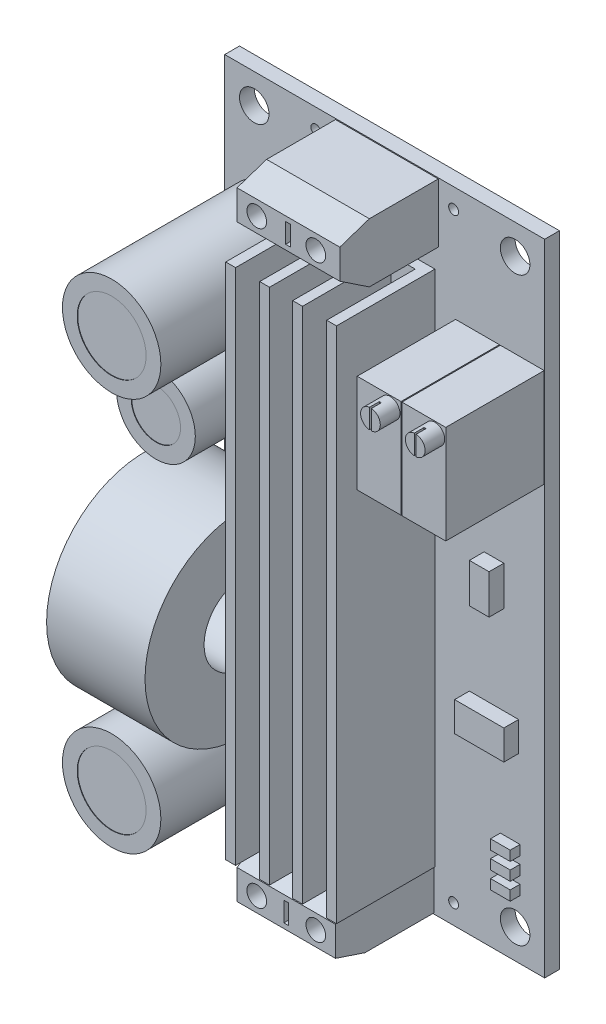
from build123d import *

# Parameters (mm, degrees)
SKETCH_1_W          = 32.5
SKETCH_1_H          = 65
SKETCH_1_R          = 1.5
EXTRUDE_1_DEPTH     = 1.5
SKETCH_2_W          = 10
SKETCH_2_H          = 6
SKETCH_2_W_2        = 10.441290105
EXTRUDE_2_DEPTH     = 10
CUT_EXTRUDE_1_DEPTH = 70.345601879
CUT_EXTRUDE_2_DEPTH = 70.482098892
SKETCH_5_W          = 4.45
SKETCH_5_H          = 10
EXTRUDE_3_DEPTH     = 10
SKETCH_6_R          = 1
EXTRUDE_4_DEPTH     = 2
SKETCH_7_W          = 0.2
SKETCH_7_H          = 2.567664245
SKETCH_7_H_2        = 2.899799918
CUT_EXTRUDE_3_DEPTH = 1
SKETCH_8_R          = 5
EXTRUDE_5_DEPTH     = 16.5
SKETCH_9_R          = 4
EXTRUDE_6_DEPTH     = 12
SKETCH_10_R         = 10
SKETCH_10_R_2       = 4
EXTRUDE_7_DEPTH     = 10
SKETCH_11_R         = 0.5
CUT_EXTRUDE_4_DEPTH = 76.400663127
SKETCH_14_W         = 11.252561251
SKETCH_14_H         = 52.6
EXTRUDE_8_DEPTH     = 1
SKETCH_15_W         = 1
SKETCH_15_H         = 52.6
EXTRUDE_9_DEPTH     = 9
SKETCH_16_W         = 5
SKETCH_16_H         = 3
SKETCH_16_W_2       = 2
SKETCH_16_H_2       = 4
EXTRUDE_10_DEPTH    = 1.5
SKETCH_17_W         = 2
SKETCH_17_H         = 1
EXTRUDE_11_DEPTH    = 1
SKETCH_18_R         = 3.5
CUT_EXTRUDE_5_DEPTH = 0.05
SKETCH_19_R         = 2.5
CUT_EXTRUDE_6_DEPTH = 0.05
SKETCH_20_R         = 1
SKETCH_20_W         = 0.5
SKETCH_20_H         = 2
CUT_EXTRUDE_7_DEPTH = 2


with BuildPart() as part:
    # 草图1 → 凸台-拉伸1 (new body)
    with BuildSketch(Plane.XY):
        with Locations((16.25, 32.5)):
            Rectangle(SKETCH_1_W, SKETCH_1_H)
        with Locations((3, 62)):
            Circle(SKETCH_1_R, mode=Mode.SUBTRACT)
        with Locations((29.5, 3)):
            Circle(SKETCH_1_R, mode=Mode.SUBTRACT)
        with Locations((3, 3)):
            Circle(SKETCH_1_R, mode=Mode.SUBTRACT)
        with Locations((29.5, 62)):
            Circle(SKETCH_1_R, mode=Mode.SUBTRACT)
    extrude(amount=EXTRUDE_1_DEPTH)

    # 草图2 → 凸台-拉伸2 (add)
    with BuildSketch(Plane.XY.offset(1.5)):
        with Locations((16.25, 3.1)):
            Rectangle(SKETCH_2_W, SKETCH_2_H)
        with Locations((16.470645053, 61.9)):
            Rectangle(SKETCH_2_W_2, SKETCH_2_H)
    extrude(amount=EXTRUDE_2_DEPTH)

    # 草图3 → 切除-拉伸1 (cut, through all)
    with BuildSketch(Plane(origin=(21.25, 0, 0), x_dir=(0, 0, -1), z_dir=(1, 0, 0))):
        Polygon((-11.5, 0.1), (-11.5, 1.1), (-8.5, 0.1), (-11.210765393, 0.1), align=None)
        Polygon((-11.5, 4.1), (-11.5, 6.1), (-8.5, 6.1), align=None)
    extrude(amount=-CUT_EXTRUDE_1_DEPTH, mode=Mode.SUBTRACT)

    # 草图4 → 切除-拉伸2 (cut, through all)
    with BuildSketch(Plane(origin=(21.691290105, 0, 0), x_dir=(0, 0, -1), z_dir=(1, 0, 0))):
        Polygon((-11.5, 58.9), (-11.5, 60.9), (-8.5, 58.9), align=None)
        Polygon((-11.5, 63.9), (-11.5, 64.9), (-8.5, 64.9), align=None)
    extrude(amount=-CUT_EXTRUDE_2_DEPTH, mode=Mode.SUBTRACT)

    # 草图5 → 凸台-拉伸3 (add)
    with BuildSketch(Plane.XY.offset(1.5)):
        with Locations((25.677561251, 48.421530787)):
            Rectangle(SKETCH_5_W, SKETCH_5_H)
        with Locations((30.227561251, 48.421530787)):
            Rectangle(SKETCH_5_W, SKETCH_5_H)
    extrude(amount=EXTRUDE_3_DEPTH)

    # 草图6 → 凸台-拉伸4 (add)
    with BuildSketch(Plane.XY.offset(11.5)):
        with Locations(Location((26.802561251, 52.321530787, 0), (0, 0, 180))):
            Circle(SKETCH_6_R)
        with Locations(Location((31.352561251, 52.321530787, 0), (0, 0, 180))):
            Circle(SKETCH_6_R)
    extrude(amount=EXTRUDE_4_DEPTH)

    # 草图7 → 切除-拉伸3 (cut)
    with BuildSketch(Plane.XY.offset(13.5)):
        with Locations((26.802561251, 52.351074518)):
            Rectangle(SKETCH_7_W, SKETCH_7_H)
        with Locations((31.352561251, 52.389397866)):
            Rectangle(SKETCH_7_W, SKETCH_7_H_2)
    extrude(amount=-CUT_EXTRUDE_3_DEPTH, mode=Mode.SUBTRACT)

    # 草图8 → 凸台-拉伸5 (add)
    with BuildSketch(Plane.XY.offset(1.5)):
        with Locations(Location((5.01, 11, 0), (0, 0, 180))):
            Circle(SKETCH_8_R)
        with Locations(Location((5.01, 51, 0), (0, 0, 180))):
            Circle(SKETCH_8_R)
    extrude(amount=EXTRUDE_5_DEPTH)

    # 草图9 → 凸台-拉伸6 (add)
    with BuildSketch(Plane.XY.offset(1.5)):
        with Locations(Location((5.01, 41.9, 0), (0, 0, 180))):
            Circle(SKETCH_9_R)
    extrude(amount=EXTRUDE_6_DEPTH)

    # 草图11 → 切除-拉伸4 (cut, through all)
    with BuildSketch(Plane.XY.offset(1.5)):
        with Locations((23.25, 2)):
            Circle(SKETCH_11_R)
        with Locations((9.25, 63)):
            Circle(SKETCH_11_R)
        with Locations((23.25, 63)):
            Circle(SKETCH_11_R)
        with Locations((9.25, 2)):
            Circle(SKETCH_11_R)
    extrude(amount=-CUT_EXTRUDE_4_DEPTH, mode=Mode.SUBTRACT)

    # 草图16 → 凸台-拉伸10 (add)
    with BuildSketch(Plane.XY.offset(1.5)):
        with Locations((27.352561251, 19.921530787)):
            Rectangle(SKETCH_16_W, SKETCH_16_H)
        with Locations((27.352561251, 32.421530787)):
            Rectangle(SKETCH_16_W_2, SKETCH_16_H_2)
    extrude(amount=EXTRUDE_10_DEPTH)

    # 草图17 → 凸台-拉伸11 (add)
    with BuildSketch(Plane.XY.offset(1.5)):
        with Locations((29, 6.5)):
            Rectangle(SKETCH_17_W, SKETCH_17_H)
        with Locations((29, 8.25)):
            Rectangle(SKETCH_17_W, SKETCH_17_H)
        with Locations((29, 10)):
            Rectangle(SKETCH_17_W, SKETCH_17_H)
    extrude(amount=EXTRUDE_11_DEPTH)

    # 草图18 → 切除-拉伸5 (cut)
    with BuildSketch(Plane.XY.offset(18)):
        with Locations((5.01, 11)):
            Circle(SKETCH_18_R)
        with Locations((5.01, 51)):
            Circle(SKETCH_18_R)
    extrude(amount=-CUT_EXTRUDE_5_DEPTH, mode=Mode.SUBTRACT)

    # 草图19 → 切除-拉伸6 (cut)
    with BuildSketch(Plane.XY.offset(13.5)):
        with Locations((5.01, 41.9)):
            Circle(SKETCH_19_R)
    extrude(amount=-CUT_EXTRUDE_6_DEPTH, mode=Mode.SUBTRACT)

    # 草图20 → 切除-拉伸7 (cut)
    with BuildSketch(Plane.XY.offset(11.5)):
        with Locations((19.25, 2.6)):
            Circle(SKETCH_20_R)
        with Locations((13.25, 2.6)):
            Circle(SKETCH_20_R)
        with Locations((19.25, 62.4)):
            Circle(SKETCH_20_R)
        with Locations((13.25, 62.4)):
            Circle(SKETCH_20_R)
        with Locations((16.25, 2.6)):
            Rectangle(SKETCH_20_W, SKETCH_20_H)
        with Locations((16.441290105, 62.4)):
            Rectangle(SKETCH_20_W, SKETCH_20_H)
    extrude(amount=-CUT_EXTRUDE_7_DEPTH, mode=Mode.SUBTRACT)


with BuildPart() as body_2:
    # 草图10 → 凸台-拉伸7 (new body)
    with BuildSketch(Plane.ZY.offset(-2)):
        with Locations((11.6, 26.1)):
            Circle(SKETCH_10_R)
        with Locations((11.6, 26.1)):
            Circle(SKETCH_10_R_2, mode=Mode.SUBTRACT)
    extrude(amount=-EXTRUDE_7_DEPTH)


with BuildPart() as body_3:
    # 草图14 → 凸台-拉伸8 (new body)
    with BuildSketch(Plane.XY.offset(3.5)):
        with Locations((17.726280626, 32.5)):
            Rectangle(SKETCH_14_W, SKETCH_14_H)
    extrude(amount=EXTRUDE_8_DEPTH)

    # 草图15 → 凸台-拉伸9 (add)
    with BuildSketch(Plane.XY.offset(4.5)):
        with Locations((22.852561251, 32.5)):
            Rectangle(SKETCH_15_W, SKETCH_15_H)
        with Locations((12.6, 32.5)):
            Rectangle(SKETCH_15_W, SKETCH_15_H)
        with Locations((19.402561251, 32.5)):
            Rectangle(SKETCH_15_W, SKETCH_15_H)
        with Locations((16.05, 32.5)):
            Rectangle(SKETCH_15_W, SKETCH_15_H)
    extrude(amount=EXTRUDE_9_DEPTH)


solid = Compound([part.part, body_2.part, body_3.part])
